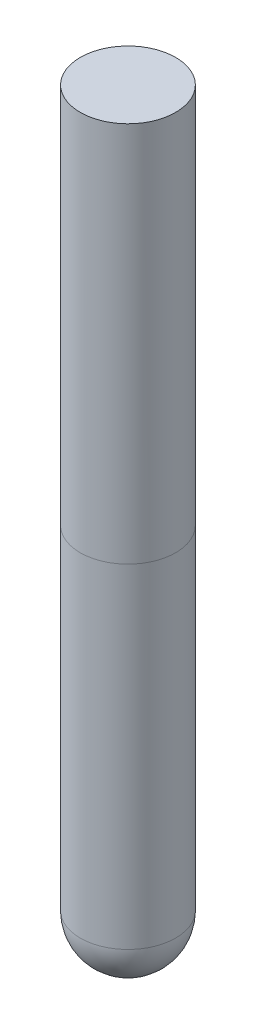
from build123d import *

# Parameters (mm, degrees)
SKETCH3_R           = 3.175
BOSS_EXTRUDE1_DEPTH = 25.4


with BuildPart() as part:
    # Sketch1 → Revolve1 (revolve)
    with BuildSketch(Plane.XY, mode=Mode.PRIVATE) as revolve1_sk:
        with BuildLine():
            Line((0, 0), (3.175, 0))
            Line((3.175, 0), (3.175, -22.225))
            ThreePointArc((3.175, -22.225), (2.24506403, -24.47006403), (0, -25.4))
            Line((0, -25.4), (0, 0))
        make_face()
    revolve(revolve1_sk.sketch.rotate(Axis((0, 0, 0), (0, -1, 0)), 180), axis=Axis((0, 0, 0), (0, -1, 0)))

    # Sketch3 → Boss-Extrude1 (add)
    with BuildSketch(Plane(origin=(0, 0, 0), x_dir=(1, 0, 0), z_dir=(0, 1, 0))):
        with Locations(Location((0, 0, 0), (0, 0, 180))):
            Circle(SKETCH3_R)
    extrude(amount=BOSS_EXTRUDE1_DEPTH)


with BuildPart() as body_2:
    # Split1: the piece on the far side of the plane
    add(part.part)
    split(bisect_by=Plane.ZX, keep=Keep.BOTTOM)


with BuildPart() as part_1:
    add(part.part)

    # Split1
    split(bisect_by=Plane.ZX, keep=Keep.TOP)


solid = Compound([body_2.part, part_1.part])
